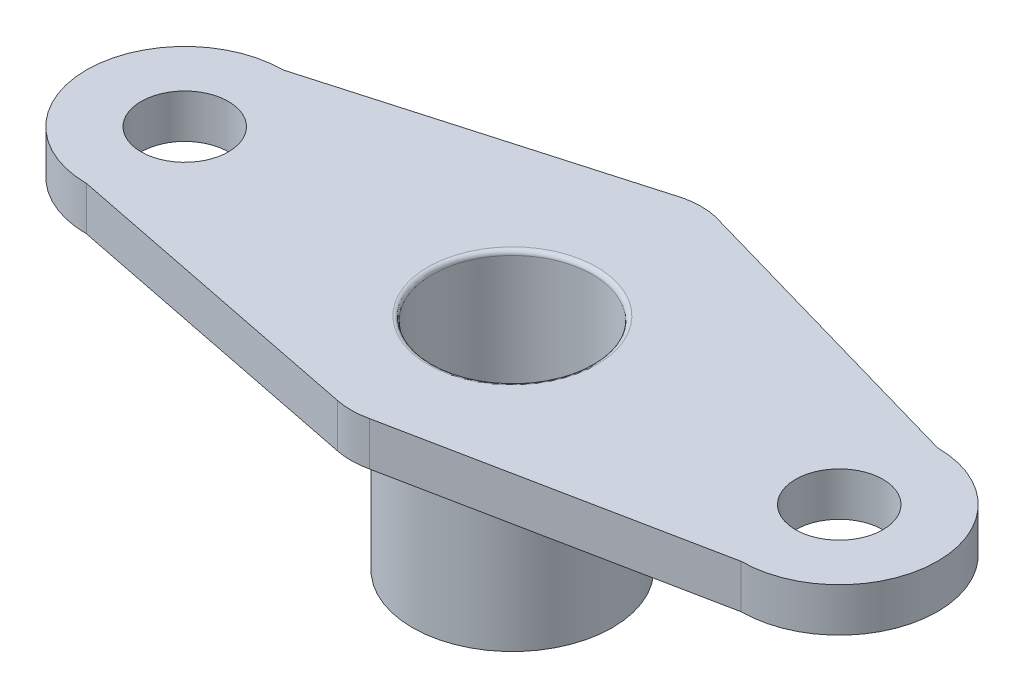
from build123d import *

# Parameters (mm, degrees)
SKETCH1_R           = 17.785523023
SKETCH1_R_2         = 10
BOSS_EXTRUDE1_DEPTH = 5
SKETCH2_R           = 22.889678729
BOSS_EXTRUDE2_DEPTH = 40.386280802
SKETCH4_R           = 18.343761553
CUT_EXTRUDE1_DEPTH  = 60
FILLET1_R           = 1


with BuildPart() as part:
    # Sketch1 → Boss-Extrude1 (new, symmetric)
    with BuildSketch(Plane(origin=(0, 0, 0), x_dir=(1, 0, 0), z_dir=(0, 1, 0))):
        with BuildLine():
            Line((-75, -22.5), (-3.19997264, -36.813396757))
            ThreePointArc((-3.19997264, -36.813396757), (0.426652195, -37.154633481), (4.043342361, -36.720579984))
            Line((4.043342361, -36.720579984), (74.823113208, -22.5))
            ThreePointArc((74.823113208, -22.5), (97.323113208, 0), (74.823113208, 22.5))
            Line((74.823113208, 22.5), (3.537735849, 42.902368838))
            ThreePointArc((3.537735849, 42.902368838), (-0.088443396, 43.290961135), (-3.714622642, 42.902368838))
            Line((-3.714622642, 42.902368838), (-75, 22.5))
            ThreePointArc((-75, 22.5), (-97.5, 0), (-75, -22.5))
        make_face()
        with Locations(Location((0, 0, 0), (0, 0, 270))):
            Circle(SKETCH1_R, mode=Mode.SUBTRACT)
        with Locations(Location((-75, 0, 0), (0, 0, 270))):
            Circle(SKETCH1_R_2, mode=Mode.SUBTRACT)
        with Locations(Location((74.823113208, 0, 0), (0, 0, 90))):
            Circle(SKETCH1_R_2, mode=Mode.SUBTRACT)
    extrude(amount=BOSS_EXTRUDE1_DEPTH, both=True)

    # Sketch2 → Boss-Extrude2 (add)
    with BuildSketch(Plane.XZ.offset(5)):
        with Locations(Location((0, 0, 0), (0, 0, 270))):
            Circle(SKETCH2_R)
    extrude(amount=BOSS_EXTRUDE2_DEPTH)

    # Sketch4 → Cut-Extrude1 (cut)
    with BuildSketch(Plane.XZ.offset(45.386280802)):
        with Locations(Location((0, 0, 0), (0, 0, 270))):
            Circle(SKETCH4_R)
    extrude(amount=-CUT_EXTRUDE1_DEPTH, mode=Mode.SUBTRACT)

    # Fillet1
    fillet1_edges = [part.edges().sort_by_distance(p)[0] for p in [
        (0, 5, 18.343761553),
    ]]
    fillet(fillet1_edges, radius=FILLET1_R)


solid = part.part
